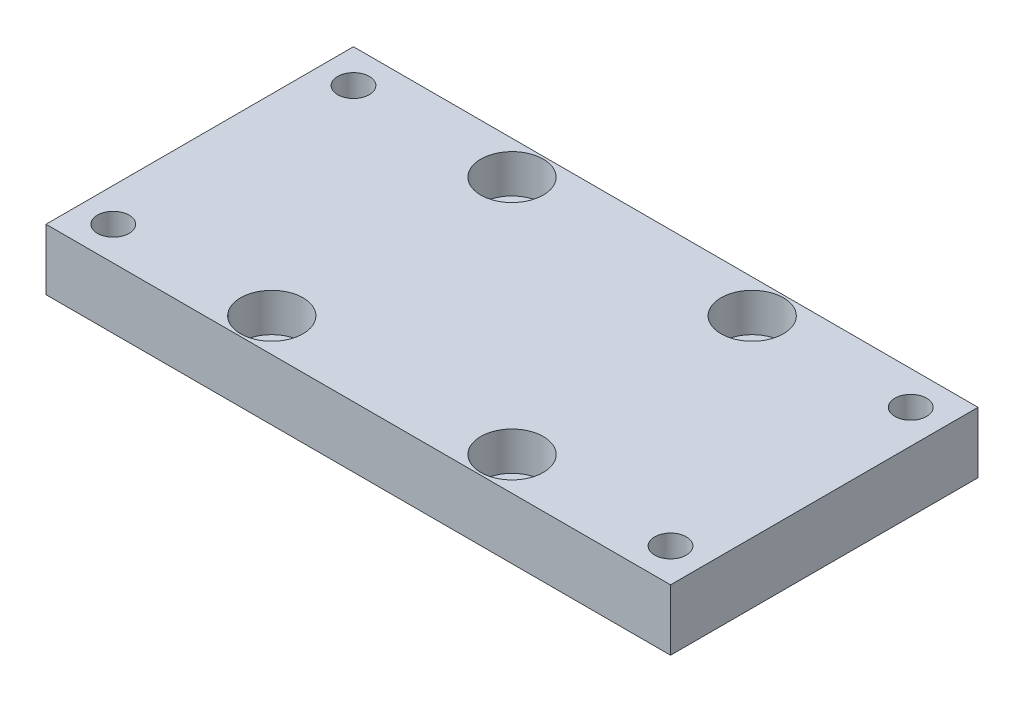
from build123d import *

# Parameters (mm, degrees)
SKETCH1_W                      = 65
SKETCH1_H                      = 32
EXTRUDE1_DEPTH                 = 6.35
CBORE_FOR_M3_SHCS2_D           = 3.4
CBORE_FOR_M3_SHCS2_CBORE_D     = 6.5
CBORE_FOR_M3_SHCS2_CBORE_DEPTH = 4
LPATTERN1_COUNT                = 2
LPATTERN1_PITCH                = 25
LPATTERN1_COUNT_DIR2           = 2
LPATTERN1_PITCH_DIR2           = 25
LPATTERN2_COUNT                = 2
LPATTERN2_PITCH                = 58
LPATTERN2_COUNT_DIR2           = 2
LPATTERN2_PITCH_DIR2           = 25


with BuildPart() as part:
    # Sketch1 → Extrude1 (new body)
    with BuildSketch(Plane(origin=(0, 0, 0), x_dir=(1, 0, 0), z_dir=(0, 1, 0))):
        Rectangle(SKETCH1_W, SKETCH1_H)
    extrude(amount=EXTRUDE1_DEPTH)

    # CBORE for M3 SHCS2 (through all)
    with Locations(Plane(origin=(-12.5, 6.35, -12.5), x_dir=(0, 0, 1), z_dir=(0, 1, 0))):
        with Locations((0, 0)):
            cbore_for_m3_shcs2 = CounterBoreHole(CBORE_FOR_M3_SHCS2_D / 2, CBORE_FOR_M3_SHCS2_CBORE_D / 2, CBORE_FOR_M3_SHCS2_CBORE_DEPTH)

    # LPattern1: CBORE for M3 SHCS2 2 × 2
    with Locations(*[(i * LPATTERN1_PITCH, 0, j * LPATTERN1_PITCH_DIR2) for i in range(LPATTERN1_COUNT) for j in range(LPATTERN1_COUNT_DIR2) if (i, j) != (0, 0)]):
        add(cbore_for_m3_shcs2, mode=Mode.SUBTRACT)

    # Sketch5 → M4x0.7 Tapped Hole1 (revolve, cut)
    with BuildSketch(Plane(origin=(-29, 6.35, -12.5), x_dir=(0, 0, 1), z_dir=(1, 0, 0))):
        Polygon((0, 0), (0, 12.491420021), (1.65, 11.5), (1.65, 0), align=None)
    m4x0_7_tapped_hole1 = revolve(axis=Axis((-29, 12.7, -12.5), (0, -1, 0)), mode=Mode.SUBTRACT)

    # LPattern2: M4x0.7 Tapped Hole1 2 × 2
    with Locations(*[(i * LPATTERN2_PITCH, 0, j * LPATTERN2_PITCH_DIR2) for i in range(LPATTERN2_COUNT) for j in range(LPATTERN2_COUNT_DIR2) if (i, j) != (0, 0)]):
        add(m4x0_7_tapped_hole1, mode=Mode.SUBTRACT)


solid = part.part
